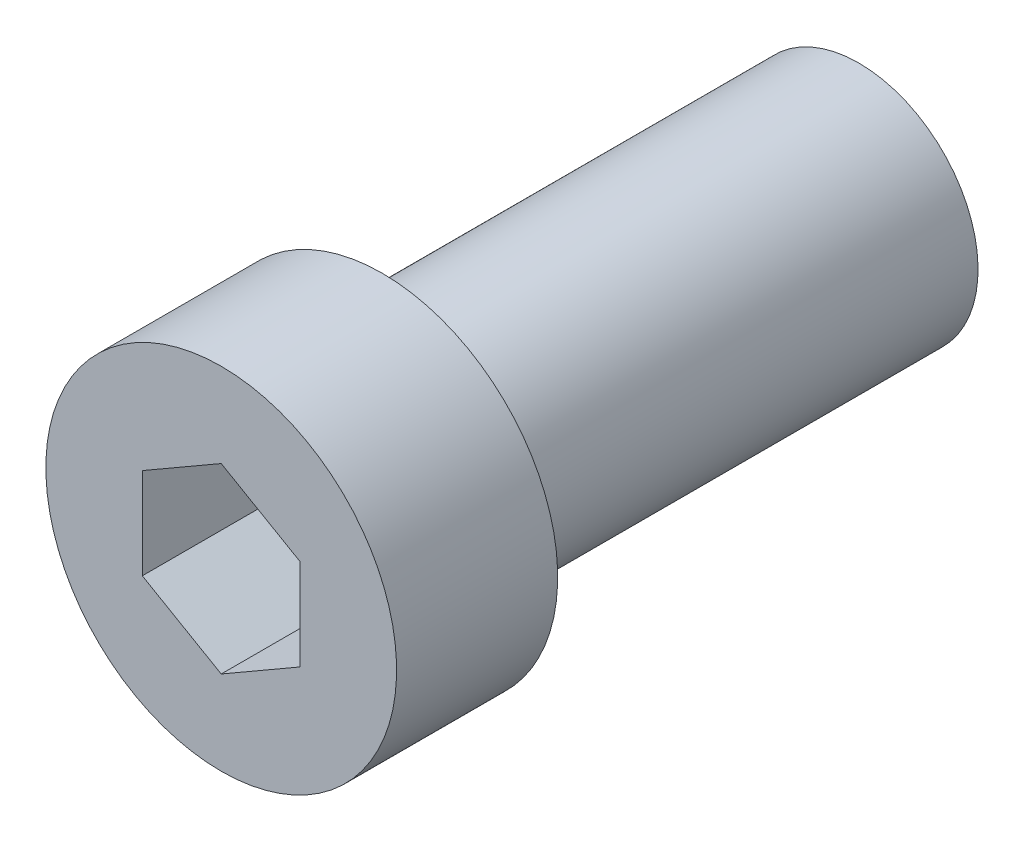
from build123d import *

# Parameters (mm, degrees)
SKETCH_1_W          = 2.208
SKETCH_1_H          = 2.028
SKETCH_2_R          = 1.5
EXTRUDE_1_DEPTH     = 6
CUT_EXTRUDE_1_DEPTH = 1.872


with BuildPart() as part:
    # 草图1 → 旋转1 (revolve)
    with BuildSketch(Plane.XZ, mode=Mode.PRIVATE) as revolve_1_sk:
        with Locations((1.104, 1.014)):
            Rectangle(SKETCH_1_W, SKETCH_1_H)
    revolve(revolve_1_sk.sketch.rotate(Axis((0, 0, 2.028), (0, 0, -1)), 270), axis=Axis((0, 0, 2.028), (0, 0, -1)))

    # 草图2 → 凸台-拉伸1 (add)
    with BuildSketch(Plane(origin=(0, 0, 0), x_dir=(-1, 0, 0), z_dir=(0, 0, -1))):
        with Locations(Location((0, 0, 0), (0, 0, 90))):
            Circle(SKETCH_2_R)
    extrude(amount=EXTRUDE_1_DEPTH)

    # 草图3 → 切除-拉伸1 (cut)
    with BuildSketch(Plane.XY.offset(2.028)):
        Polygon((0.9936, -0.573655227), (0.9936, 0.573655227), (0, 1.147310455), (-0.9936, 0.573655227), (-0.9936, -0.573655227), (0, -1.147310455), align=None)
    extrude(amount=-CUT_EXTRUDE_1_DEPTH, mode=Mode.SUBTRACT)


solid = part.part
